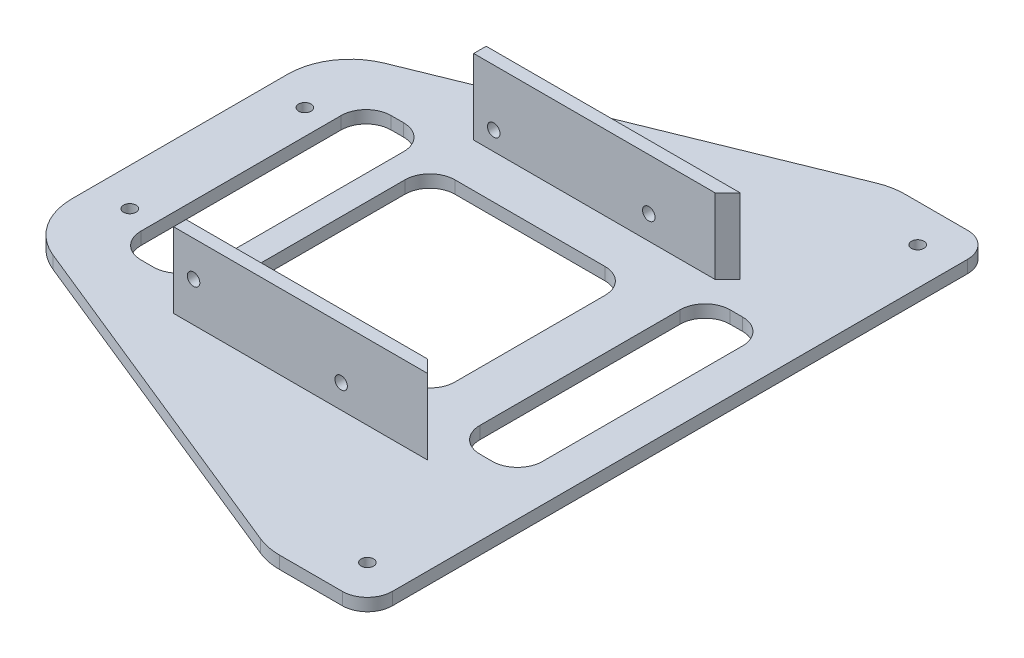
from build123d import *

# Parameters (mm, degrees)
RESSALTO_EXTRUS_O1_DEPTH = 5
ESBO_O2_R                = 2.5
CORTE_EXTRUS_O1_DEPTH    = 218.591641723
RESSALTO_EXTRUS_O2_DEPTH = 30
ESBO_O5_R                = 2.5
CORTE_EXTRUS_O2_DEPTH    = 5
ESBO_O6_R                = 2.5
CORTE_EXTRUS_O3_DEPTH    = 5
CORTE_EXTRUS_O4_DEPTH    = 10


with BuildPart() as part:
    # Esboço1 → Ressalto-extrusão1 (new body)
    with BuildSketch(Plane(origin=(0, 0, 0), x_dir=(1, 0, 0), z_dir=(0, 1, 0))):
        with BuildLine():
            Line((66.608430389, -57.715517241), (91.724137931, -57.715517241))
            ThreePointArc((91.724137931, -57.715517241), (98.795205743, -54.786585053), (101.724137931, -47.715517241))
            Line((101.724137931, -47.715517241), (101.724137931, 182.284482759))
            ThreePointArc((101.724137931, 182.284482759), (98.795205743, 189.35555057), (91.724137931, 192.284482759))
            Line((91.724137931, 192.284482759), (66.608430389, 192.284482759))
            ThreePointArc((66.608430389, 192.284482759), (61.814768465, 191.820595029), (57.199004215, 190.446147187))
            Line((57.199004215, 190.446147187), (-82.685288243, 133.618153375))
            ThreePointArc((-82.685288243, 133.618153375), (-94.015144293, 124.416509464), (-98.275862069, 110.456488947))
            Line((-98.275862069, 110.456488947), (-98.275862069, 24.11247657))
            ThreePointArc((-98.275862069, 24.11247657), (-94.015144293, 10.152456053), (-82.685288243, 0.950812142))
            Line((-82.685288243, 0.950812142), (57.199004215, -55.877181669))
            ThreePointArc((57.199004215, -55.877181669), (61.814768465, -57.251629512), (66.608430389, -57.715517241))
        make_face()
    extrude(amount=RESSALTO_EXTRUS_O1_DEPTH)

    # Esboço2 → Corte-extrusão1 (cut, through all)
    with BuildSketch(Plane(origin=(0, 5, 0), x_dir=(1, 0, 0), z_dir=(0, 1, 0))):
        with Locations(Location((-83.275862069, 102.284482759, 0), (0, 0, 270))):
            Circle(ESBO_O2_R)
        with Locations(Location((86.724137931, 177.284482759, 0), (0, 0, 90))):
            Circle(ESBO_O2_R)
        with Locations(Location((86.724137931, -42.715517241, 0), (0, 0, 270))):
            Circle(ESBO_O2_R)
        with Locations(Location((-83.275862069, 32.284482759, 0), (0, 0, 90))):
            Circle(ESBO_O2_R)
        with BuildLine():
            Line((31.724137931, 107.284482759), (-28.275862069, 107.284482759))
            ThreePointArc((-28.275862069, 107.284482759), (-35.346929881, 104.35555057), (-38.275862069, 97.284482759))
            Line((-38.275862069, 97.284482759), (-38.275862069, 37.284482759))
            ThreePointArc((-38.275862069, 37.284482759), (-35.346929881, 30.213414947), (-28.275862069, 27.284482759))
            Line((-28.275862069, 27.284482759), (31.724137931, 27.284482759))
            ThreePointArc((31.724137931, 27.284482759), (38.795205743, 30.213414947), (41.724137931, 37.284482759))
            Line((41.724137931, 37.284482759), (41.724137931, 97.284482759))
            ThreePointArc((41.724137931, 97.284482759), (38.795205743, 104.35555057), (31.724137931, 107.284482759))
        make_face()
    extrude(amount=-CORTE_EXTRUS_O1_DEPTH, mode=Mode.SUBTRACT)

    # Esboço4 → Ressalto-extrusão2 (add)
    with BuildSketch(Plane(origin=(0, 5, 0), x_dir=(1, 0, 0), z_dir=(0, 1, 0))):
        Polygon((58.224137931, 9.784482759), (-38.275862069, 9.784482759), (-38.275862069, 4.784482759), (63.224137931, 4.784482759), align=None)
        Polygon((58.224137931, 124.784482759), (-38.275862069, 124.784482759), (-38.275862069, 129.784482759), (63.224137931, 129.784482759), align=None)
    extrude(amount=RESSALTO_EXTRUS_O2_DEPTH)

    # Esboço5 → Corte-extrusão2 (cut)
    with BuildSketch(Plane.XY.offset(-4.784482759)):
        with Locations((-30.275862069, 20.836178243)):
            Circle(ESBO_O5_R)
        with Locations((28.724137931, 14.5)):
            Circle(ESBO_O5_R)
    extrude(amount=-CORTE_EXTRUS_O2_DEPTH, mode=Mode.SUBTRACT)

    # Esboço6 → Corte-extrusão3 (cut)
    with BuildSketch(Plane(origin=(0, 0, -129.784482759), x_dir=(-1, 0, 0), z_dir=(0, 0, -1))):
        with Locations((-31.724137931, 14.5)):
            Circle(ESBO_O6_R)
        with Locations((30.275862069, 12.5)):
            Circle(ESBO_O6_R)
    extrude(amount=-CORTE_EXTRUS_O3_DEPTH, mode=Mode.SUBTRACT)

    # Esboço7 → Corte-extrusão4 (cut)
    with BuildSketch(Plane(origin=(0, 5, 0), x_dir=(1, 0, 0), z_dir=(0, 1, 0))):
        with BuildLine():
            Line((76.724137931, 117.284482759), (71.724137931, 117.284482759))
            ThreePointArc((71.724137931, 117.284482759), (64.653070119, 114.35555057), (61.724137931, 107.284482759))
            Line((61.724137931, 107.284482759), (61.724137931, 27.284482759))
            ThreePointArc((61.724137931, 27.284482759), (64.653070119, 20.213414947), (71.724137931, 17.284482759))
            Line((71.724137931, 17.284482759), (76.724137931, 17.284482759))
            ThreePointArc((76.724137931, 17.284482759), (83.795205743, 20.213414947), (86.724137931, 27.284482759))
            Line((86.724137931, 27.284482759), (86.724137931, 107.284482759))
            ThreePointArc((86.724137931, 107.284482759), (83.795205743, 114.35555057), (76.724137931, 117.284482759))
        make_face()
        with BuildLine():
            Line((-58.289420658, 116.784482759), (-63.289420658, 116.784482759))
            ThreePointArc((-63.289420658, 116.784482759), (-70.36048847, 113.85555057), (-73.289420658, 106.784482759))
            Line((-73.289420658, 106.784482759), (-73.289420658, 26.784482759))
            ThreePointArc((-73.289420658, 26.784482759), (-70.36048847, 19.713414947), (-63.289420658, 16.784482759))
            Line((-63.289420658, 16.784482759), (-58.289420658, 16.784482759))
            ThreePointArc((-58.289420658, 16.784482759), (-51.218352846, 19.713414947), (-48.289420658, 26.784482759))
            Line((-48.289420658, 26.784482759), (-48.289420658, 106.784482759))
            ThreePointArc((-48.289420658, 106.784482759), (-51.218352846, 113.85555057), (-58.289420658, 116.784482759))
        make_face()
    extrude(amount=-CORTE_EXTRUS_O4_DEPTH, mode=Mode.SUBTRACT)


solid = part.part
